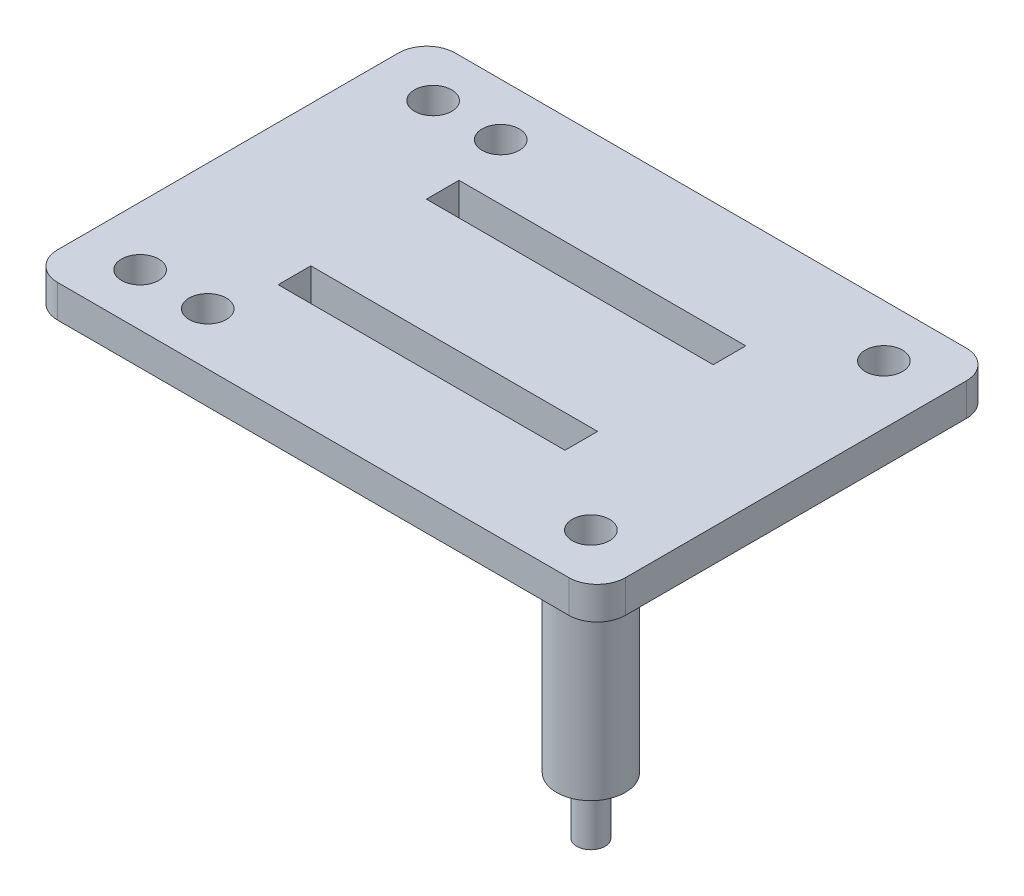
from build123d import *

# Parameters (mm, degrees)
SKETCH_3_W          = 80
SKETCH_3_H          = 56
EXTRUDE_1_DEPTH     = 4.6
SKETCH_1_R          = 2.625
SKETCH_1_W          = 40.4
SKETCH_1_H          = 4.6
CUT_EXTRUDE_1_DEPTH = 4.6
SKETCH_5_R          = 4.85
EXTRUDE_2_DEPTH     = 25
SKETCH_6_R          = 2
EXTRUDE_3_DEPTH     = 8
FILLET_2_R          = 4


with BuildPart() as part:
    # 草图3 → 凸台-拉伸1 (new body)
    with BuildSketch(Plane(origin=(0, 0, 0), x_dir=(1, 0, 0), z_dir=(0, 1, 0))):
        Rectangle(SKETCH_3_W, SKETCH_3_H)
    extrude(amount=EXTRUDE_1_DEPTH)

    # 草图1 → 切除-拉伸1 (cut)
    with BuildSketch(Plane(origin=(0, 0, 0), x_dir=(1, 0, 0), z_dir=(0, 1, 0))):
        with Locations(Location((-31.75, 20.6375, 0), (0, 0, 90))):
            Circle(SKETCH_1_R)
        with Locations(Location((31.75, 20.6375, 0), (0, 0, 90))):
            Circle(SKETCH_1_R)
        with Locations(Location((31.75, -20.6375, 0), (0, 0, 90))):
            Circle(SKETCH_1_R)
        with Locations(Location((-31.75, -20.6375, 0), (0, 0, 90))):
            Circle(SKETCH_1_R)
        with Locations(Location((-22.225, 20.6375, 0), (0, 0, 90))):
            Circle(SKETCH_1_R)
        with Locations(Location((-22.225, -20.6375, 0), (0, 0, 90))):
            Circle(SKETCH_1_R)
        with Locations((0, -10.4375)):
            Rectangle(SKETCH_1_W, SKETCH_1_H)
        with Locations((0, 10.4375)):
            Rectangle(SKETCH_1_W, SKETCH_1_H)
    extrude(amount=CUT_EXTRUDE_1_DEPTH, mode=Mode.SUBTRACT)

    # 草图5 → 凸台-拉伸2 (add)
    with BuildSketch(Plane.XZ):
        with Locations(Location((31.75, 20.6375, 0), (0, 0, 270))):
            Circle(SKETCH_5_R)
    extrude(amount=EXTRUDE_2_DEPTH)

    # 草图6 → 凸台-拉伸3 (add)
    with BuildSketch(Plane.XZ.offset(25)):
        with Locations(Location((31.75, 20.6375, 0), (0, 0, 270))):
            Circle(SKETCH_6_R)
    extrude(amount=EXTRUDE_3_DEPTH)

    # 圆角2
    fillet_2_edges = [part.edges().sort_by_distance(p)[0] for p in [
        (40, 2.3, 28),
        (-40, 2.3, 28),
        (-40, 2.3, -28),
        (40, 2.3, -28),
    ]]
    fillet(fillet_2_edges, radius=FILLET_2_R)


solid = part.part
